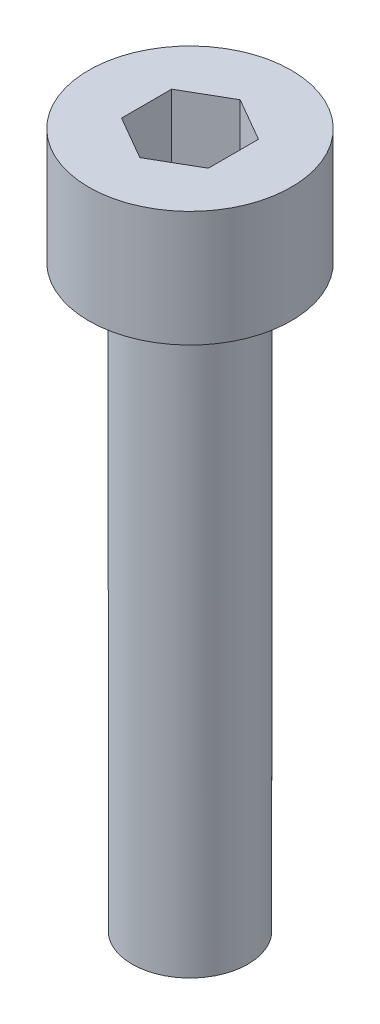
from build123d import *

# Parameters (mm, degrees)
SKETCH2_R           = 3.5
BOSS_EXTRUDE1_DEPTH = 4
SKETCH3_R           = 2
BOSS_EXTRUDE2_DEPTH = 20


with BuildPart() as part:
    # Sketch2 → Boss-Extrude1 (new body)
    with BuildSketch(Plane(origin=(0, 0, 0), x_dir=(1, 0, 0), z_dir=(0, 1, 0))):
        with Locations(Location((0, 0, 0), (0, 0, 270))):
            Circle(SKETCH2_R)
        Polygon((0, 1.732050808), (-1.5, 0.866025404), (-1.5, -0.866025404), (0, -1.732050808), (1.5, -0.866025404), (1.5, 0.866025404), align=None, mode=Mode.SUBTRACT)
    extrude(amount=BOSS_EXTRUDE1_DEPTH)

    # Sketch3 → Boss-Extrude2 (add)
    with BuildSketch(Plane.XZ):
        with Locations(Location((0, 0, 0), (0, 0, 90))):
            Circle(SKETCH3_R)
    extrude(amount=BOSS_EXTRUDE2_DEPTH)


solid = part.part
